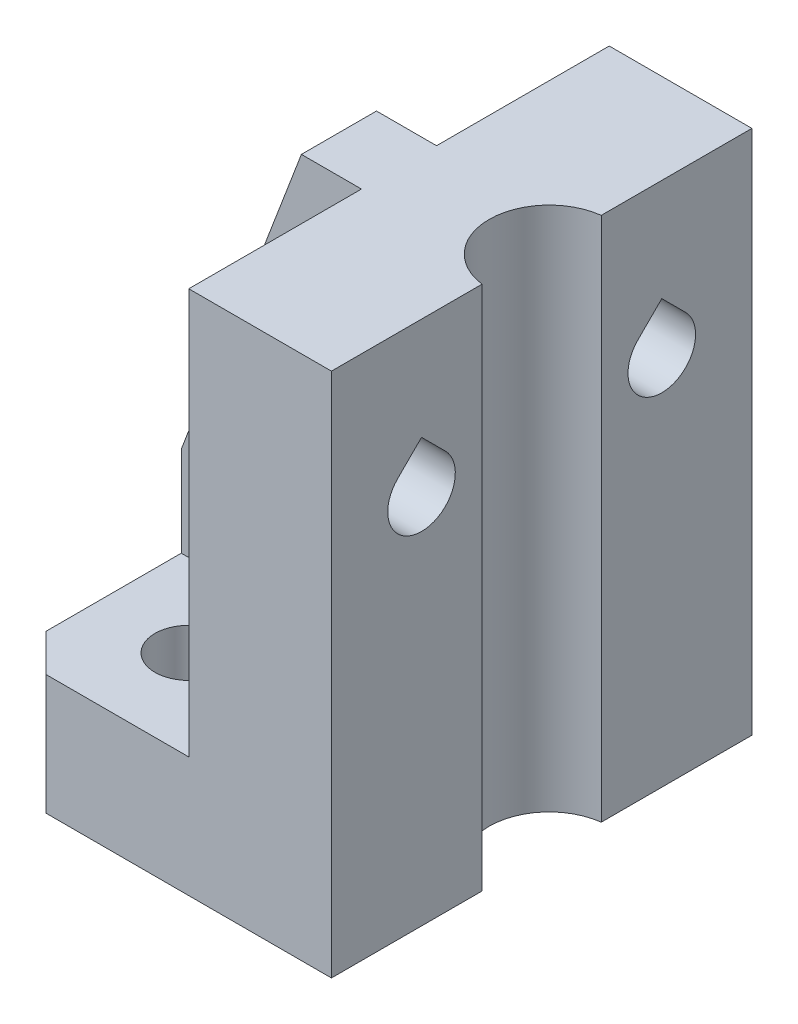
from build123d import *

# Parameters (mm, degrees)
BOSS_EXTRUDE1_DEPTH = 14
SKETCH2_R           = 4
CUT_EXTRUDE1_DEPTH  = 44.646305686
SKETCH3_W           = 0.5
SKETCH3_H           = 28
CUT_EXTRUDE2_DEPTH  = 44.646305686
SKETCH4_R           = 2.25
CUT_EXTRUDE3_DEPTH  = 38.536648758
CUT_EXTRUDE4_DEPTH  = 40.56008089
CHAMFER1_SIZE       = 2.5
BOSS_EXTRUDE2_DEPTH = 2.5


with BuildPart() as part:
    # Sketch1 → Boss-Extrude1 (new, symmetric)
    with BuildSketch(Plane.XY):
        Polygon((0, 0), (-22, 0), (-22, 8), (-10, 8), (-10, 35), (0, 35), align=None)
    extrude(amount=BOSS_EXTRUDE1_DEPTH, both=True)

    # Sketch2 → Cut-Extrude1 (cut, through all)
    with BuildSketch(Plane(origin=(0, 35, 0), x_dir=(1, 0, 0), z_dir=(0, 1, 0))):
        Circle(SKETCH2_R)
    extrude(amount=-CUT_EXTRUDE1_DEPTH, mode=Mode.SUBTRACT)

    # Sketch3 → Cut-Extrude2 (cut, through all)
    with BuildSketch(Plane(origin=(0, 35, 0), x_dir=(1, 0, 0), z_dir=(0, 1, 0))):
        with Locations((-0.25, 0)):
            Rectangle(SKETCH3_W, SKETCH3_H)
    extrude(amount=-CUT_EXTRUDE2_DEPTH, mode=Mode.SUBTRACT)

    # Sketch4 → Cut-Extrude3 (cut, through all)
    with BuildSketch(Plane(origin=(0, 8, 0), x_dir=(1, 0, 0), z_dir=(0, 1, 0))):
        with Locations(Location((-16, 8, 0), (0, 0, 180))):
            Circle(SKETCH4_R)
        with Locations(Location((-16, -8, 0), (0, 0, 180))):
            Circle(SKETCH4_R)
    extrude(amount=-CUT_EXTRUDE3_DEPTH, mode=Mode.SUBTRACT)

    # Sketch5 → Cut-Extrude4 (cut, through all)
    with BuildSketch(Plane.ZY.offset(10)):
        with BuildLine():
            Line((6.409009742, 26.590990258), (8, 28.181980515))
            Line((8, 28.181980515), (9.590990258, 26.590990258))
            ThreePointArc((9.590990258, 26.590990258), (8, 22.75), (6.409009742, 26.590990258))
        make_face()
        with BuildLine():
            Line((-9.590990258, 26.590990258), (-8, 28.181980515))
            Line((-8, 28.181980515), (-6.409009742, 26.590990258))
            ThreePointArc((-6.409009742, 26.590990258), (-8, 22.75), (-9.590990258, 26.590990258))
        make_face()
    extrude(amount=-CUT_EXTRUDE4_DEPTH, mode=Mode.SUBTRACT)

    # Chamfer1
    chamfer1_edges = [part.edges().sort_by_distance(p)[0] for p in [
        (-22, 4, 14),
        (-22, 4, -14),
    ]]
    chamfer(chamfer1_edges, length=CHAMFER1_SIZE)

    # Sketch6 → Boss-Extrude2 (add, symmetric)
    with BuildSketch(Plane.XY):
        Polygon((-22, 8), (-22, 14), (-14, 35), (-10, 35), (-10, 8), align=None)
    extrude(amount=BOSS_EXTRUDE2_DEPTH, both=True)


solid = part.part
